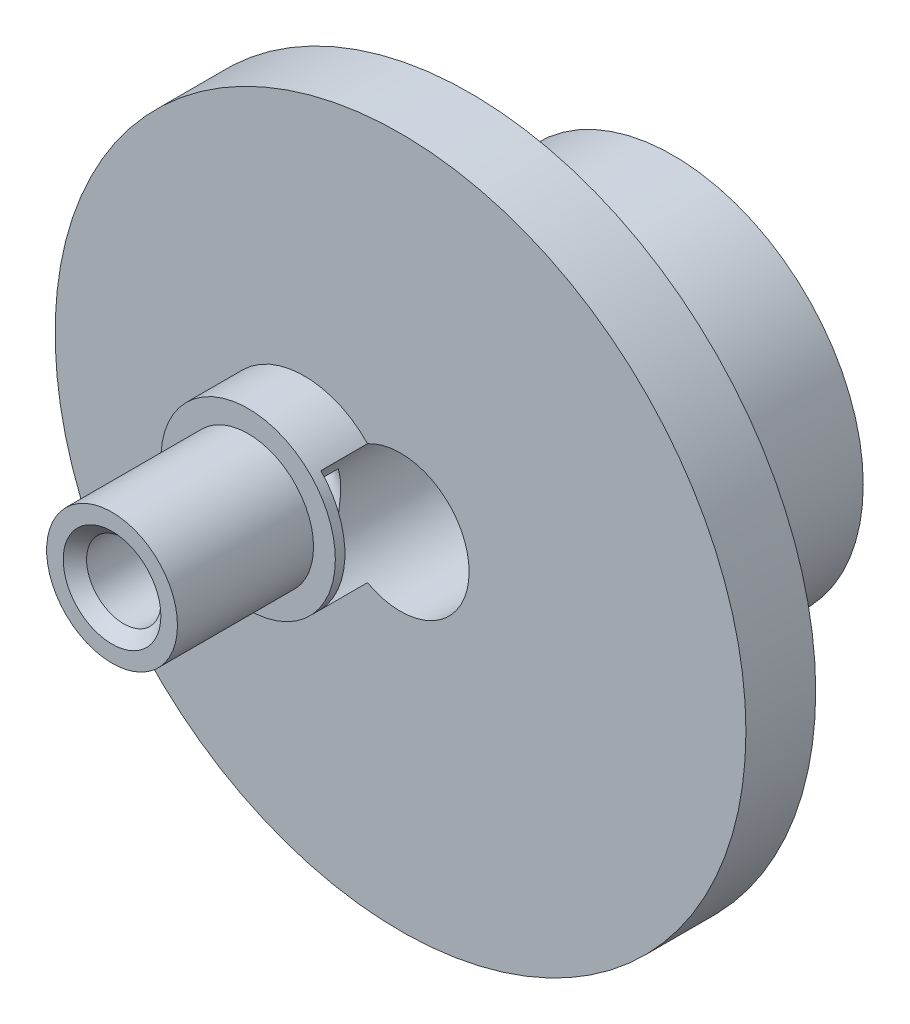
from build123d import *

# Parameters (mm, degrees)
SKETCH1_R                       = 6.9215
SKETCH1_R_2                     = 0.127
BOSS_EXTRUDE1_DEPTH             = 10.922
SKETCH2_R                       = 2.38125
BOSS_EXTRUDE2_DEPTH             = 6.00075
BOSS_EXTRUDE3_START             = -0.762
SKETCH4_R                       = 6.9215
BOSS_EXTRUDE3_DEPTH             = 0.762
SKETCH5_R                       = 3.175
BOSS_EXTRUDE4_DEPTH             = 1.04775
F_6_32_TAPPED_HOLE1_D           = 2.7051
F_6_32_TAPPED_HOLE1_DEPTH       = 7.112
F_6_32_TAPPED_HOLE1_CSINK_D     = 3.556
F_6_32_TAPPED_HOLE1_CSINK_ANGLE = 90
F_6_32_TAPPED_HOLE1_TIP         = 0.81269403
SKETCH9_R                       = 0.127
CUT_EXTRUDE2_DEPTH              = 15.108150995
SKETCH13_R                      = 2.49682
CUT_EXTRUDE5_DEPTH              = 11.6205
SKETCH15_OUTSIDE_W              = 21.02
SKETCH15_OUTSIDE_H              = 21.02
SKETCH15_OUTSIDE_R              = 3.175
CUT_EXTRUDE7_DEPTH              = 1.000000032
BOSS_EXTRUDE6_START             = -2.54
SKETCH16_R                      = 12.573
SKETCH16_R_2                    = 6.9215
BOSS_EXTRUDE6_DEPTH             = 2.54


with BuildPart() as part:
    # Sketch1 → Boss-Extrude1 (new body)
    with BuildSketch(Plane.XY):
        Circle(SKETCH1_R)
        Circle(SKETCH1_R_2, mode=Mode.SUBTRACT)
    extrude(amount=BOSS_EXTRUDE1_DEPTH)

    # Sketch2 → Boss-Extrude2 (add)
    with BuildSketch(Plane.XY.offset(10.922)):
        with Locations((-3.5, 0)):
            Circle(SKETCH2_R)
    extrude(amount=BOSS_EXTRUDE2_DEPTH)

    # Sketch4 → Boss-Extrude3 (add)
    with BuildSketch(Plane.XY.offset(10.922).offset(BOSS_EXTRUDE3_START)):
        Circle(SKETCH4_R)
    extrude(amount=BOSS_EXTRUDE3_DEPTH)

    # Sketch5 → Boss-Extrude4 (add)
    with BuildSketch(Plane.XY.offset(10.922)):
        with Locations(Location((-3.5, 0, 0), (0, 0, 43.593288384))):
            Circle(SKETCH5_R)
    extrude(amount=BOSS_EXTRUDE4_DEPTH)

    # #6-32 Tapped Hole1
    with Locations(Plane.XY.offset(16.92275)):
        with Locations((-3.5, 0)):
            CounterSinkHole(F_6_32_TAPPED_HOLE1_D / 2, F_6_32_TAPPED_HOLE1_CSINK_D / 2, depth=F_6_32_TAPPED_HOLE1_DEPTH, counter_sink_angle=F_6_32_TAPPED_HOLE1_CSINK_ANGLE)
            with Locations((0, 0, -(F_6_32_TAPPED_HOLE1_DEPTH + F_6_32_TAPPED_HOLE1_TIP / 2))):  # 118° drill point
                Cone(0, F_6_32_TAPPED_HOLE1_D / 2, F_6_32_TAPPED_HOLE1_TIP, mode=Mode.SUBTRACT)

    # Sketch9 → Cut-Extrude2 (cut, through all)
    with BuildSketch(Plane(origin=(0, 0, 10.16), x_dir=(-1, 0, 0), z_dir=(0, 0, -1))):
        Circle(SKETCH9_R)
    extrude(amount=-CUT_EXTRUDE2_DEPTH, mode=Mode.SUBTRACT)

    # Sketch13 → Cut-Extrude5 (cut)
    with BuildSketch(Plane(origin=(0, 0, 0), x_dir=(-1, 0, 0), z_dir=(0, 0, -1))):
        Circle(SKETCH13_R)
    extrude(amount=-CUT_EXTRUDE5_DEPTH, mode=Mode.SUBTRACT)

    # Sketch15 outside → Cut-Extrude7 (cut)
    with BuildSketch(Plane.XY.offset(10.922)):
        Rectangle(SKETCH15_OUTSIDE_W, SKETCH15_OUTSIDE_H)
        with Locations(Location((-3.5, 0, 0), (0, 0, 43.593288384))):
            Circle(SKETCH15_OUTSIDE_R, mode=Mode.SUBTRACT)
    extrude(amount=-CUT_EXTRUDE7_DEPTH, mode=Mode.SUBTRACT)

    # Sketch16 → Boss-Extrude6 (add)
    with BuildSketch(Plane.XY.offset(9.921999968).offset(BOSS_EXTRUDE6_START)):
        Circle(SKETCH16_R)
        Circle(SKETCH16_R_2, mode=Mode.SUBTRACT)
    extrude(amount=BOSS_EXTRUDE6_DEPTH)


solid = part.part
